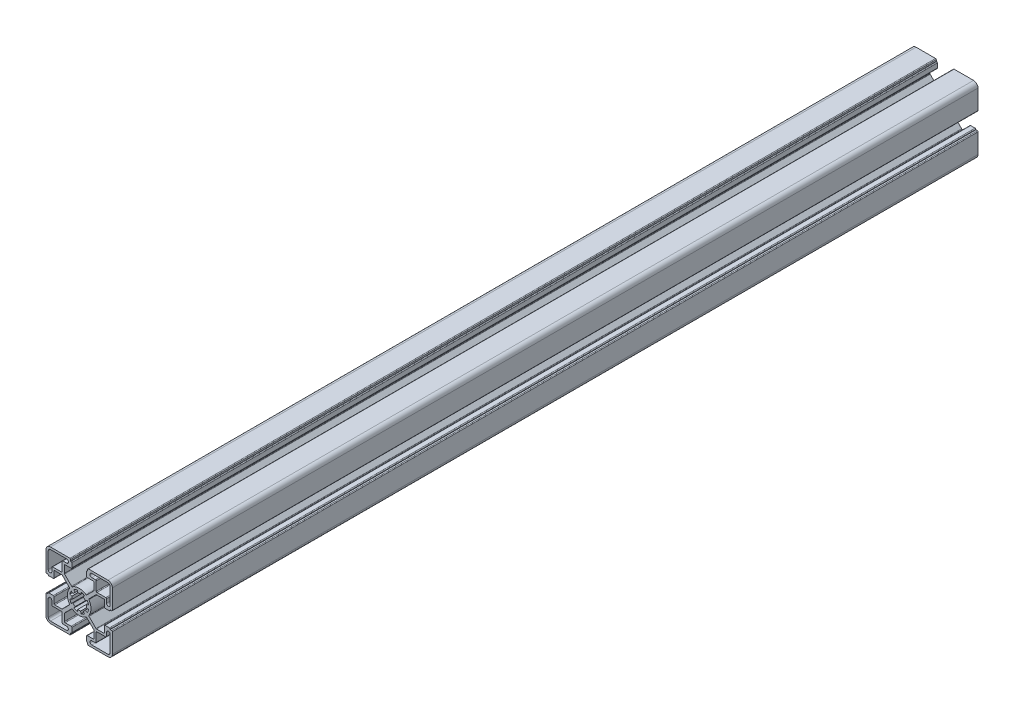
from build123d import *

# Parameters (mm, degrees)
BOSS_EXTRUDE1_DEPTH      = 152.4
BOSS_EXTRUDE1_DEPTH_BACK = 152.4
SKETCH3_R                = 5
FILLET1_R                = 0.5
CUT_EXTRUDE1_DEPTH       = 307.456424309
BOSS_EXTRUDE2_DEPTH      = 282.099999934


with BuildPart() as part:
    # Sketch3 → Boss-Extrude1 (new, two sides: drawn at the far end of the back side and taken through both)
    with BuildSketch(Plane.XY.offset(-BOSS_EXTRUDE1_DEPTH_BACK)):
        with BuildLine():
            Line((-11.55, -10.05), (-6.356915373, -4.856915373))
            ThreePointArc((-6.356915373, -4.856915373), (-8, 0), (-6.356915373, 4.856915373))
            Line((-6.356915373, 4.856915373), (-11.55, 10.05))
            Line((-11.55, 10.05), (-17.025, 10.05))
            Line((-17.025, 10.05), (-17.025, 5))
            Line((-17.025, 5), (-21, 5))
            Line((-21, 5), (-21, 5.8))
            Line((-21, 5.8), (-22.5, 5.8))
            Line((-22.5, 5.8), (-22.5, 19.5))
            ThreePointArc((-22.5, 19.5), (-21.621320344, 21.621320344), (-19.5, 22.5))
            Line((-19.5, 22.5), (-5.8, 22.5))
            Line((-5.8, 22.5), (-5.8, 21))
            Line((-5.8, 21), (-5, 21))
            Line((-5, 21), (-5, 17.025))
            Line((-5, 17.025), (-10.05, 17.025))
            Line((-10.05, 17.025), (-10.05, 11.55))
            Line((-10.05, 11.55), (-4.856915373, 6.356915373))
            ThreePointArc((-4.856915373, 6.356915373), (0, 8), (4.856915373, 6.356915373))
            Line((4.856915373, 6.356915373), (10.05, 11.55))
            Line((10.05, 11.55), (10.05, 17.025))
            Line((10.05, 17.025), (5, 17.025))
            Line((5, 17.025), (5, 21))
            Line((5, 21), (5.8, 21))
            Line((5.8, 21), (5.8, 22.5))
            Line((5.8, 22.5), (19.5, 22.5))
            ThreePointArc((19.5, 22.5), (21.621320344, 21.621320344), (22.5, 19.5))
            Line((22.5, 19.5), (22.5, 5.8))
            Line((22.5, 5.8), (21, 5.8))
            Line((21, 5.8), (21, 5))
            Line((21, 5), (17.025, 5))
            Line((17.025, 5), (17.025, 10.05))
            Line((17.025, 10.05), (11.55, 10.05))
            Line((11.55, 10.05), (6.356915373, 4.856915373))
            ThreePointArc((6.356915373, 4.856915373), (8, 0), (6.356915373, -4.856915373))
            Line((6.356915373, -4.856915373), (11.55, -10.05))
            Line((11.55, -10.05), (17.025, -10.05))
            Line((17.025, -10.05), (17.025, -5))
            Line((17.025, -5), (21, -5))
            Line((21, -5), (21, -5.8))
            Line((21, -5.8), (22.5, -5.8))
            Line((22.5, -5.8), (22.5, -19.5))
            ThreePointArc((22.5, -19.5), (21.621320344, -21.621320344), (19.5, -22.5))
            Line((19.5, -22.5), (5.8, -22.5))
            Line((5.8, -22.5), (5.8, -21))
            Line((5.8, -21), (5, -21))
            Line((5, -21), (5, -17.025))
            Line((5, -17.025), (10.05, -17.025))
            Line((10.05, -17.025), (10.05, -11.55))
            Line((10.05, -11.55), (4.856915373, -6.356915373))
            ThreePointArc((4.856915373, -6.356915373), (0, -8), (-4.856915373, -6.356915373))
            Line((-4.856915373, -6.356915373), (-10.05, -11.55))
            Line((-10.05, -11.55), (-10.05, -17.025))
            Line((-10.05, -17.025), (-5, -17.025))
            Line((-5, -17.025), (-5, -21))
            Line((-5, -21), (-5.8, -21))
            Line((-5.8, -21), (-5.8, -22.5))
            Line((-5.8, -22.5), (-19.5, -22.5))
            ThreePointArc((-19.5, -22.5), (-21.621320344, -21.621320344), (-22.5, -19.5))
            Line((-22.5, -19.5), (-22.5, -5.8))
            Line((-22.5, -5.8), (-21, -5.8))
            Line((-21, -5.8), (-21, -5))
            Line((-21, -5), (-17.025, -5))
            Line((-17.025, -5), (-17.025, -10.05))
            Line((-17.025, -10.05), (-11.55, -10.05))
        make_face()
        with Locations(Location((0, 0, 0), (0, 0, 180))):
            Circle(SKETCH3_R, mode=Mode.SUBTRACT)
        with BuildLine():
            Line((-21, 8.5375), (-21, 19.5))
            ThreePointArc((-21, 19.5), (-20.560660172, 20.560660172), (-19.5, 21))
            Line((-19.5, 21), (-8.5375, 21))
            ThreePointArc((-8.5375, 21), (-7.3, 19.7625), (-8.5375, 18.525))
            Line((-8.5375, 18.525), (-11.55, 18.525))
            Line((-11.55, 18.525), (-11.55, 11.55))
            Line((-11.55, 11.55), (-18.525, 11.55))
            Line((-18.525, 11.55), (-18.525, 8.5375))
            ThreePointArc((-18.525, 8.5375), (-19.7625, 7.3), (-21, 8.5375))
        make_face(mode=Mode.SUBTRACT)
        with BuildLine():
            Line((8.5375, 21), (19.5, 21))
            ThreePointArc((19.5, 21), (20.560660172, 20.560660172), (21, 19.5))
            Line((21, 19.5), (21, 8.5375))
            ThreePointArc((21, 8.5375), (19.7625, 7.3), (18.525, 8.5375))
            Line((18.525, 8.5375), (18.525, 11.55))
            Line((18.525, 11.55), (11.55, 11.55))
            Line((11.55, 11.55), (11.55, 18.525))
            Line((11.55, 18.525), (8.5375, 18.525))
            ThreePointArc((8.5375, 18.525), (7.3, 19.7625), (8.5375, 21))
        make_face(mode=Mode.SUBTRACT)
        with BuildLine():
            Line((21, -8.5375), (21, -19.5))
            ThreePointArc((21, -19.5), (20.560660172, -20.560660172), (19.5, -21))
            Line((19.5, -21), (8.5375, -21))
            ThreePointArc((8.5375, -21), (7.3, -19.7625), (8.5375, -18.525))
            Line((8.5375, -18.525), (11.55, -18.525))
            Line((11.55, -18.525), (11.55, -11.55))
            Line((11.55, -11.55), (18.525, -11.55))
            Line((18.525, -11.55), (18.525, -8.5375))
            ThreePointArc((18.525, -8.5375), (19.7625, -7.3), (21, -8.5375))
        make_face(mode=Mode.SUBTRACT)
        with BuildLine():
            Line((-8.5375, -21), (-19.5, -21))
            ThreePointArc((-19.5, -21), (-20.560660172, -20.560660172), (-21, -19.5))
            Line((-21, -19.5), (-21, -8.5375))
            ThreePointArc((-21, -8.5375), (-19.7625, -7.3), (-18.525, -8.5375))
            Line((-18.525, -8.5375), (-18.525, -11.55))
            Line((-18.525, -11.55), (-11.55, -11.55))
            Line((-11.55, -11.55), (-11.55, -18.525))
            Line((-11.55, -18.525), (-8.5375, -18.525))
            ThreePointArc((-8.5375, -18.525), (-7.3, -19.7625), (-8.5375, -21))
        make_face(mode=Mode.SUBTRACT)
    extrude(amount=BOSS_EXTRUDE1_DEPTH + BOSS_EXTRUDE1_DEPTH_BACK)

    # Fillet1
    fillet1_edges = [part.edges().sort_by_distance(p)[0] for p in [
        (-11.55, -18.525, 0),
        (-11.55, -11.55, 0),
        (18.525, -11.55, 0),
        (11.55, -11.55, 0),
        (11.55, -18.525, 0),
        (11.55, 18.525, 0),
        (11.55, 11.55, 0),
        (18.525, 11.55, 0),
        (-18.525, 11.55, 0),
        (-11.55, 11.55, 0),
        (-11.55, 18.525, 0),
        (6.356915373, -4.856915373, 0),
        (11.55, -10.05, 0),
        (17.025, -10.05, 0),
        (17.025, -5, 0),
        (21, -5, 0),
        (22.5, -5.8, 0),
        (5.8, -22.5, 0),
        (5, -21, 0),
        (5, -17.025, 0),
        (10.05, -17.025, 0),
        (10.05, -11.55, 0),
        (4.856915373, -6.356915373, 0),
        (-4.856915373, -6.356915373, 0),
        (-10.05, -11.55, 0),
        (-10.05, -17.025, 0),
        (-5, -17.025, 0),
        (-5, -21, 0),
        (-5.8, -22.5, 0),
        (-22.5, -5.8, 0),
        (-21, -5, 0),
        (-17.025, -5, 0),
        (-17.025, -10.05, 0),
        (-11.55, -10.05, 0),
        (-6.356915373, -4.856915373, 0),
        (-6.356915373, 4.856915373, 0),
        (-11.55, 10.05, 0),
        (-17.025, 10.05, 0),
        (-17.025, 5, 0),
        (-21, 5, 0),
        (-22.5, 5.8, 0),
        (-5.8, 22.5, 0),
        (-5, 21, 0),
        (-5, 17.025, 0),
        (-10.05, 17.025, 0),
        (-10.05, 11.55, 0),
        (-4.856915373, 6.356915373, 0),
        (4.856915373, 6.356915373, 0),
        (10.05, 11.55, 0),
        (10.05, 17.025, 0),
        (5, 17.025, 0),
        (5, 21, 0),
        (5.8, 22.5, 0),
        (22.5, 5.8, 0),
        (21, 5, 0),
        (17.025, 5, 0),
        (11.55, 10.05, 0),
        (6.356915373, 4.856915373, 0),
    ]]
    fillet(fillet1_edges, radius=FILLET1_R)

    # Sketch4 → Cut-Extrude1 (cut, through all)
    with BuildSketch(Plane.XY.offset(152.4)):
        with BuildLine():
            Line((-1.268087093, 6.375104323), (-0.97545161, 4.903926402))
            ThreePointArc((-0.97545161, 4.903926402), (-1.913417162, 4.619397663), (-2.777851165, 4.157348062))
            Line((-2.777851165, 4.157348062), (-3.611206515, 5.40455248))
            ThreePointArc((-3.611206515, 5.40455248), (-2.48744231, 6.005216961), (-1.268087093, 6.375104323))
        make_face()
        with BuildLine():
            Line((1.268087093, 6.375104323), (0.97545161, 4.903926402))
            ThreePointArc((0.97545161, 4.903926402), (1.913417162, 4.619397663), (2.777851165, 4.157348062))
            Line((2.777851165, 4.157348062), (3.611206515, 5.40455248))
            ThreePointArc((3.611206515, 5.40455248), (2.48744231, 6.005216961), (1.268087093, 6.375104323))
        make_face()
        with BuildLine():
            Line((5.40455248, 3.611206515), (4.157348062, 2.777851165))
            ThreePointArc((4.157348062, 2.777851165), (4.619397663, 1.913417162), (4.903926402, 0.97545161))
            Line((4.903926402, 0.97545161), (6.375104323, 1.268087093))
            ThreePointArc((6.375104323, 1.268087093), (6.005216961, 2.48744231), (5.40455248, 3.611206515))
        make_face()
        with BuildLine():
            Line((6.375104323, -1.268087093), (4.903926402, -0.97545161))
            ThreePointArc((4.903926402, -0.97545161), (4.619397663, -1.913417162), (4.157348062, -2.777851165))
            Line((4.157348062, -2.777851165), (5.40455248, -3.611206515))
            ThreePointArc((5.40455248, -3.611206515), (6.005216961, -2.48744231), (6.375104323, -1.268087093))
        make_face()
        with BuildLine():
            Line((3.611206515, -5.40455248), (2.777851165, -4.157348062))
            ThreePointArc((2.777851165, -4.157348062), (1.913417162, -4.619397663), (0.97545161, -4.903926402))
            Line((0.97545161, -4.903926402), (1.268087093, -6.375104323))
            ThreePointArc((1.268087093, -6.375104323), (2.48744231, -6.005216961), (3.611206515, -5.40455248))
        make_face()
        with BuildLine():
            Line((-1.268087093, -6.375104323), (-0.97545161, -4.903926402))
            ThreePointArc((-0.97545161, -4.903926402), (-1.913417162, -4.619397663), (-2.777851165, -4.157348062))
            Line((-2.777851165, -4.157348062), (-3.611206515, -5.40455248))
            ThreePointArc((-3.611206515, -5.40455248), (-2.48744231, -6.005216961), (-1.268087093, -6.375104323))
        make_face()
        with BuildLine():
            Line((-5.40455248, -3.611206515), (-4.157348062, -2.777851165))
            ThreePointArc((-4.157348062, -2.777851165), (-4.619397663, -1.913417162), (-4.903926402, -0.97545161))
            Line((-4.903926402, -0.97545161), (-6.375104323, -1.268087093))
            ThreePointArc((-6.375104323, -1.268087093), (-6.005216961, -2.48744231), (-5.40455248, -3.611206515))
        make_face()
        with BuildLine():
            Line((-6.375104323, 1.268087093), (-4.903926402, 0.97545161))
            ThreePointArc((-4.903926402, 0.97545161), (-4.619397663, 1.913417162), (-4.157348062, 2.777851165))
            Line((-4.157348062, 2.777851165), (-5.40455248, 3.611206515))
            ThreePointArc((-5.40455248, 3.611206515), (-6.005216961, 2.48744231), (-6.375104323, 1.268087093))
        make_face()
    extrude(amount=-CUT_EXTRUDE1_DEPTH, mode=Mode.SUBTRACT)

    # Sketch6 → Boss-Extrude2 (add)
    with BuildSketch(Plane.XY.offset(152.4)):
        with BuildLine():
            Line((22.5, -19.5), (22.5, -6.3))
            ThreePointArc((22.5, -6.3), (22.353553391, -5.946446609), (22, -5.8))
            Line((22, -5.8), (21, -5.8))
            Line((21, -5.8), (21, -5.5))
            ThreePointArc((21, -5.5), (20.853553391, -5.146446609), (20.5, -5))
            Line((20.5, -5), (17.525, -5))
            ThreePointArc((17.525, -5), (17.171446609, -5.146446609), (17.025, -5.5))
            Line((17.025, -5.5), (17.025, -9.55))
            ThreePointArc((17.025, -9.55), (16.878553391, -9.903553391), (16.525, -10.05))
            Line((16.525, -10.05), (11.757106781, -10.05))
            ThreePointArc((11.757106781, -10.05), (11.565765065, -10.011939766), (11.403553391, -9.903553391))
            Line((11.403553391, -9.903553391), (6.658229, -5.158229))
            ThreePointArc((6.658229, -5.158229), (6.513911961, -4.850773717), (6.599324603, -4.522047632))
            ThreePointArc((6.599324603, -4.522047632), (8, 0), (6.599324603, 4.522047632))
            ThreePointArc((6.599324603, 4.522047632), (6.513911961, 4.850773717), (6.658229, 5.158229))
            Line((6.658229, 5.158229), (11.403553391, 9.903553391))
            ThreePointArc((11.403553391, 9.903553391), (11.565765065, 10.011939766), (11.757106781, 10.05))
            Line((11.757106781, 10.05), (17.025, 10.05))
            Line((17.025, 10.05), (17.025, 5.5))
            ThreePointArc((17.025, 5.5), (17.171446609, 5.146446609), (17.525, 5))
            Line((17.525, 5), (20.5, 5))
            ThreePointArc((20.5, 5), (20.853553391, 5.146446609), (21, 5.5))
            Line((21, 5.5), (21, 5.8))
            Line((21, 5.8), (22, 5.8))
            ThreePointArc((22, 5.8), (22.353553391, 5.946446609), (22.5, 6.3))
            Line((22.5, 6.3), (22.5, 19.5))
            ThreePointArc((22.5, 19.5), (21.621320344, 21.621320344), (19.5, 22.5))
            Line((19.5, 22.5), (6.3, 22.5))
            ThreePointArc((6.3, 22.5), (5.946446609, 22.353553391), (5.8, 22))
            Line((5.8, 22), (5.8, 21))
            Line((5.8, 21), (5.5, 21))
            ThreePointArc((5.5, 21), (5.146446609, 20.853553391), (5, 20.5))
            Line((5, 20.5), (5, 17.525))
            ThreePointArc((5, 17.525), (5.146446609, 17.171446609), (5.5, 17.025))
            Line((5.5, 17.025), (9.55, 17.025))
            ThreePointArc((9.55, 17.025), (9.903553391, 16.878553391), (10.05, 16.525))
            Line((10.05, 16.525), (10.05, 11.757106781))
            ThreePointArc((10.05, 11.757106781), (10.011939766, 11.565765065), (9.903553391, 11.403553391))
            Line((9.903553391, 11.403553391), (5.158229, 6.658229))
            ThreePointArc((5.158229, 6.658229), (4.850773717, 6.513911961), (4.522047632, 6.599324603))
            ThreePointArc((4.522047632, 6.599324603), (0, 8), (-4.522047632, 6.599324603))
            ThreePointArc((-4.522047632, 6.599324603), (-4.850773717, 6.513911961), (-5.158229, 6.658229))
            Line((-5.158229, 6.658229), (-9.903553391, 11.403553391))
            ThreePointArc((-9.903553391, 11.403553391), (-10.011939766, 11.565765065), (-10.05, 11.757106781))
            Line((-10.05, 11.757106781), (-10.05, 16.525))
            ThreePointArc((-10.05, 16.525), (-9.903553391, 16.878553391), (-9.55, 17.025))
            Line((-9.55, 17.025), (-5.5, 17.025))
            ThreePointArc((-5.5, 17.025), (-5.146446609, 17.171446609), (-5, 17.525))
            Line((-5, 17.525), (-5, 20.5))
            ThreePointArc((-5, 20.5), (-5.146446609, 20.853553391), (-5.5, 21))
            Line((-5.5, 21), (-5.8, 21))
            Line((-5.8, 21), (-5.8, 22))
            ThreePointArc((-5.8, 22), (-5.946446609, 22.353553391), (-6.3, 22.5))
            Line((-6.3, 22.5), (-19.5, 22.5))
            ThreePointArc((-19.5, 22.5), (-21.621320344, 21.621320344), (-22.5, 19.5))
            Line((-22.5, 19.5), (-22.5, 6.3))
            ThreePointArc((-22.5, 6.3), (-22.353553391, 5.946446609), (-22, 5.8))
            Line((-22, 5.8), (-21, 5.8))
            Line((-21, 5.8), (-21, 5.5))
            ThreePointArc((-21, 5.5), (-20.853553391, 5.146446609), (-20.5, 5))
            Line((-20.5, 5), (-17.525, 5))
            ThreePointArc((-17.525, 5), (-17.171446609, 5.146446609), (-17.025, 5.5))
            Line((-17.025, 5.5), (-17.025, 9.55))
            ThreePointArc((-17.025, 9.55), (-16.878553391, 9.903553391), (-16.525, 10.05))
            Line((-16.525, 10.05), (-11.757106781, 10.05))
            ThreePointArc((-11.757106781, 10.05), (-11.565765065, 10.011939766), (-11.403553391, 9.903553391))
            Line((-11.403553391, 9.903553391), (-6.658229, 5.158229))
            ThreePointArc((-6.658229, 5.158229), (-6.513911961, 4.850773717), (-6.599324603, 4.522047632))
            ThreePointArc((-6.599324603, 4.522047632), (-8, 0), (-6.599324603, -4.522047632))
            ThreePointArc((-6.599324603, -4.522047632), (-6.513911961, -4.850773717), (-6.658229, -5.158229))
            Line((-6.658229, -5.158229), (-11.403553391, -9.903553391))
            ThreePointArc((-11.403553391, -9.903553391), (-11.565765065, -10.011939766), (-11.757106781, -10.05))
            Line((-11.757106781, -10.05), (-16.525, -10.05))
            ThreePointArc((-16.525, -10.05), (-16.878553391, -9.903553391), (-17.025, -9.55))
            Line((-17.025, -9.55), (-17.025, -5.5))
            ThreePointArc((-17.025, -5.5), (-17.171446609, -5.146446609), (-17.525, -5))
            Line((-17.525, -5), (-20.5, -5))
            ThreePointArc((-20.5, -5), (-20.853553391, -5.146446609), (-21, -5.5))
            Line((-21, -5.5), (-21, -5.8))
            Line((-21, -5.8), (-22, -5.8))
            ThreePointArc((-22, -5.8), (-22.353553391, -5.946446609), (-22.5, -6.3))
            Line((-22.5, -6.3), (-22.5, -19.5))
            ThreePointArc((-22.5, -19.5), (-21.621320344, -21.621320344), (-19.5, -22.5))
            Line((-19.5, -22.5), (-6.3, -22.5))
            ThreePointArc((-6.3, -22.5), (-5.946446609, -22.353553391), (-5.8, -22))
            Line((-5.8, -22), (-5.8, -21))
            Line((-5.8, -21), (-5.5, -21))
            ThreePointArc((-5.5, -21), (-5.146446609, -20.853553391), (-5, -20.5))
            Line((-5, -20.5), (-5, -17.525))
            ThreePointArc((-5, -17.525), (-5.146446609, -17.171446609), (-5.5, -17.025))
            Line((-5.5, -17.025), (-9.55, -17.025))
            ThreePointArc((-9.55, -17.025), (-9.903553391, -16.878553391), (-10.05, -16.525))
            Line((-10.05, -16.525), (-10.05, -11.757106781))
            ThreePointArc((-10.05, -11.757106781), (-10.011939766, -11.565765065), (-9.903553391, -11.403553391))
            Line((-9.903553391, -11.403553391), (-5.158229, -6.658229))
            ThreePointArc((-5.158229, -6.658229), (-4.850773717, -6.513911961), (-4.522047632, -6.599324603))
            ThreePointArc((-4.522047632, -6.599324603), (0, -8), (4.522047632, -6.599324603))
            ThreePointArc((4.522047632, -6.599324603), (4.850773717, -6.513911961), (5.158229, -6.658229))
            Line((5.158229, -6.658229), (9.903553391, -11.403553391))
            ThreePointArc((9.903553391, -11.403553391), (10.011939766, -11.565765065), (10.05, -11.757106781))
            Line((10.05, -11.757106781), (10.05, -16.525))
            ThreePointArc((10.05, -16.525), (9.903553391, -16.878553391), (9.55, -17.025))
            Line((9.55, -17.025), (5.5, -17.025))
            ThreePointArc((5.5, -17.025), (5.146446609, -17.171446609), (5, -17.525))
            Line((5, -17.525), (5, -20.5))
            ThreePointArc((5, -20.5), (5.146446609, -20.853553391), (5.5, -21))
            Line((5.5, -21), (5.8, -21))
            Line((5.8, -21), (5.8, -22))
            ThreePointArc((5.8, -22), (5.946446609, -22.353553391), (6.3, -22.5))
            Line((6.3, -22.5), (19.5, -22.5))
            ThreePointArc((19.5, -22.5), (21.621320344, -21.621320344), (22.5, -19.5))
        make_face()
        with BuildLine():
            Line((-11.55, -18.025), (-11.55, -12.05))
            ThreePointArc((-11.55, -12.05), (-11.696446609, -11.696446609), (-12.05, -11.55))
            Line((-12.05, -11.55), (-18.525, -11.55))
            Line((-18.525, -11.55), (-18.525, -8.5375))
            ThreePointArc((-18.525, -8.5375), (-19.7625, -7.3), (-21, -8.5375))
            Line((-21, -8.5375), (-21, -19.5))
            ThreePointArc((-21, -19.5), (-20.560660172, -20.560660172), (-19.5, -21))
            Line((-19.5, -21), (-8.5375, -21))
            ThreePointArc((-8.5375, -21), (-7.3, -19.7625), (-8.5375, -18.525))
            Line((-8.5375, -18.525), (-11.05, -18.525))
            ThreePointArc((-11.05, -18.525), (-11.403553391, -18.378553391), (-11.55, -18.025))
        make_face(mode=Mode.SUBTRACT)
        with BuildLine():
            Line((-0.97545161, 4.903926402), (-1.268087093, 6.375104323))
            ThreePointArc((-1.268087093, 6.375104323), (-2.48744231, 6.005216961), (-3.611206515, 5.40455248))
            Line((-3.611206515, 5.40455248), (-2.777851165, 4.157348062))
            ThreePointArc((-2.777851165, 4.157348062), (-3.535533906, 3.535533906), (-4.157348062, 2.777851165))
            Line((-4.157348062, 2.777851165), (-5.40455248, 3.611206515))
            ThreePointArc((-5.40455248, 3.611206515), (-6.005216961, 2.48744231), (-6.375104323, 1.268087093))
            Line((-6.375104323, 1.268087093), (-4.903926402, 0.97545161))
            ThreePointArc((-4.903926402, 0.97545161), (-5, 0), (-4.903926402, -0.97545161))
            Line((-4.903926402, -0.97545161), (-6.375104323, -1.268087093))
            ThreePointArc((-6.375104323, -1.268087093), (-6.005216961, -2.48744231), (-5.40455248, -3.611206515))
            Line((-5.40455248, -3.611206515), (-4.157348062, -2.777851165))
            ThreePointArc((-4.157348062, -2.777851165), (-3.535533906, -3.535533906), (-2.777851165, -4.157348062))
            Line((-2.777851165, -4.157348062), (-3.611206515, -5.40455248))
            ThreePointArc((-3.611206515, -5.40455248), (-2.48744231, -6.005216961), (-1.268087093, -6.375104323))
            Line((-1.268087093, -6.375104323), (-0.97545161, -4.903926402))
            ThreePointArc((-0.97545161, -4.903926402), (0, -5), (0.97545161, -4.903926402))
            Line((0.97545161, -4.903926402), (1.268087093, -6.375104323))
            ThreePointArc((1.268087093, -6.375104323), (2.48744231, -6.005216961), (3.611206515, -5.40455248))
            Line((3.611206515, -5.40455248), (2.777851165, -4.157348062))
            ThreePointArc((2.777851165, -4.157348062), (3.535533906, -3.535533906), (4.157348062, -2.777851165))
            Line((4.157348062, -2.777851165), (5.40455248, -3.611206515))
            ThreePointArc((5.40455248, -3.611206515), (6.005216961, -2.48744231), (6.375104323, -1.268087093))
            Line((6.375104323, -1.268087093), (4.903926402, -0.97545161))
            ThreePointArc((4.903926402, -0.97545161), (5, 0), (4.903926402, 0.97545161))
            Line((4.903926402, 0.97545161), (6.375104323, 1.268087093))
            ThreePointArc((6.375104323, 1.268087093), (6.005216961, 2.48744231), (5.40455248, 3.611206515))
            Line((5.40455248, 3.611206515), (4.157348062, 2.777851165))
            ThreePointArc((4.157348062, 2.777851165), (3.535533906, 3.535533906), (2.777851165, 4.157348062))
            Line((2.777851165, 4.157348062), (3.611206515, 5.40455248))
            ThreePointArc((3.611206515, 5.40455248), (2.48744231, 6.005216961), (1.268087093, 6.375104323))
            Line((1.268087093, 6.375104323), (0.97545161, 4.903926402))
            ThreePointArc((0.97545161, 4.903926402), (0, 5), (-0.97545161, 4.903926402))
        make_face(mode=Mode.SUBTRACT)
        with BuildLine():
            Line((18.025, -11.55), (12.05, -11.55))
            ThreePointArc((12.05, -11.55), (11.696446609, -11.696446609), (11.55, -12.05))
            Line((11.55, -12.05), (11.55, -18.025))
            ThreePointArc((11.55, -18.025), (11.403553391, -18.378553391), (11.05, -18.525))
            Line((11.05, -18.525), (8.5375, -18.525))
            ThreePointArc((8.5375, -18.525), (7.3, -19.7625), (8.5375, -21))
            Line((8.5375, -21), (19.5, -21))
            ThreePointArc((19.5, -21), (20.560660172, -20.560660172), (21, -19.5))
            Line((21, -19.5), (21, -8.5375))
            ThreePointArc((21, -8.5375), (19.7625, -7.3), (18.525, -8.5375))
            Line((18.525, -8.5375), (18.525, -11.05))
            ThreePointArc((18.525, -11.05), (18.378553391, -11.403553391), (18.025, -11.55))
        make_face(mode=Mode.SUBTRACT)
        with BuildLine():
            Line((11.55, 18.025), (11.55, 12.05))
            ThreePointArc((11.55, 12.05), (11.696446609, 11.696446609), (12.05, 11.55))
            Line((12.05, 11.55), (18.025, 11.55))
            ThreePointArc((18.025, 11.55), (18.378553391, 11.403553391), (18.525, 11.05))
            Line((18.525, 11.05), (18.525, 8.5375))
            ThreePointArc((18.525, 8.5375), (19.7625, 7.3), (21, 8.5375))
            Line((21, 8.5375), (21, 19.5))
            ThreePointArc((21, 19.5), (20.560660172, 20.560660172), (19.5, 21))
            Line((19.5, 21), (8.5375, 21))
            ThreePointArc((8.5375, 21), (7.3, 19.7625), (8.5375, 18.525))
            Line((8.5375, 18.525), (11.05, 18.525))
            ThreePointArc((11.05, 18.525), (11.403553391, 18.378553391), (11.55, 18.025))
        make_face(mode=Mode.SUBTRACT)
        with BuildLine():
            Line((-18.025, 11.55), (-12.05, 11.55))
            ThreePointArc((-12.05, 11.55), (-11.696446609, 11.696446609), (-11.55, 12.05))
            Line((-11.55, 12.05), (-11.55, 18.025))
            ThreePointArc((-11.55, 18.025), (-11.403553391, 18.378553391), (-11.05, 18.525))
            Line((-11.05, 18.525), (-8.5375, 18.525))
            ThreePointArc((-8.5375, 18.525), (-7.3, 19.7625), (-8.5375, 21))
            Line((-8.5375, 21), (-19.5, 21))
            ThreePointArc((-19.5, 21), (-20.560660172, 20.560660172), (-21, 19.5))
            Line((-21, 19.5), (-21, 8.5375))
            ThreePointArc((-21, 8.5375), (-19.7625, 7.3), (-18.525, 8.5375))
            Line((-18.525, 8.5375), (-18.525, 11.05))
            ThreePointArc((-18.525, 11.05), (-18.378553391, 11.403553391), (-18.025, 11.55))
        make_face(mode=Mode.SUBTRACT)
    extrude(amount=BOSS_EXTRUDE2_DEPTH)


solid = part.part
